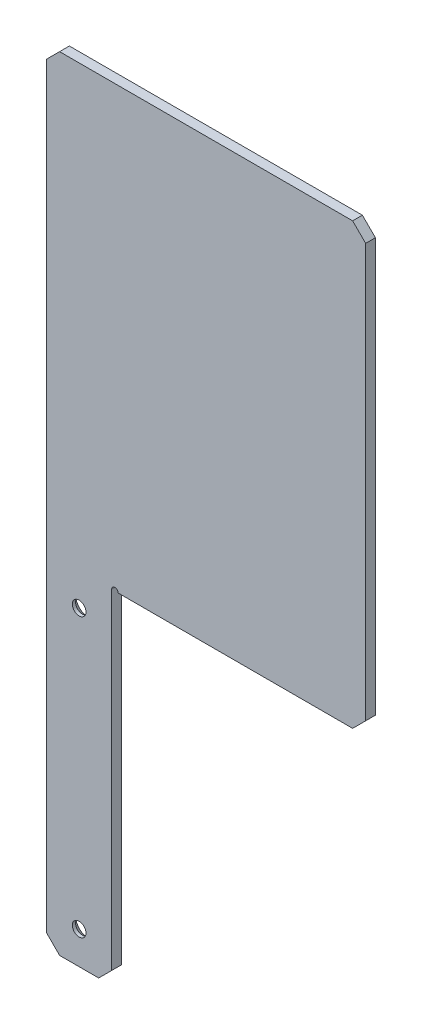
from build123d import *

# Parameters (mm, degrees)
EXTRUDE_1_DEPTH     = 1.5
CHAMFER_1_SIZE      = 4
SKETCH_2_R          = 1
CUT_EXTRUDE_1_DEPTH = 130.838515087
SKETCH_3_R          = 2.1
CUT_EXTRUDE_2_DEPTH = 130.838515087
CHAMFER_2_SIZE      = 2


with BuildPart() as part:
    # 草图1 → 凸台-拉伸1 (new, symmetric)
    with BuildSketch(Plane.XY):
        Polygon((-49, -120.2), (-29, -120.2), (-29, -14.8), (49, -14.8), (49, 120.2), (-49, 120.2), (-49, -14.8), align=None)
    extrude(amount=EXTRUDE_1_DEPTH, both=True)

    # 倒角1
    chamfer_1_edges = [part.edges().sort_by_distance(p)[0] for p in [
        (-49, 120.2, 0),
        (49, 120.2, 0),
        (49, -14.8, 0),
        (-29, -120.2, 0),
        (-49, -120.2, 0),
    ]]
    chamfer(chamfer_1_edges, length=CHAMFER_1_SIZE)

    # 草图2 → 切除-拉伸1 (cut, through all)
    with BuildSketch(Plane.XY.offset(1.5)):
        with Locations((-28, -14.8)):
            Circle(SKETCH_2_R)
    extrude(amount=-CUT_EXTRUDE_1_DEPTH, mode=Mode.SUBTRACT)

    # 草图3 → 切除-拉伸2 (cut, through all)
    with BuildSketch(Plane.XY.offset(1.5)):
        with Locations((-39, -110.2)):
            Circle(SKETCH_3_R)
        with Locations((-39, -24.8)):
            Circle(SKETCH_3_R)
    extrude(amount=-CUT_EXTRUDE_2_DEPTH, mode=Mode.SUBTRACT)

    # 倒角2
    chamfer_2_edges = [part.edges().sort_by_distance(p)[0] for p in [
        (-41.1, -110.2, -1.5),
        (-41.1, -24.8, -1.5),
    ]]
    chamfer(chamfer_2_edges, length=CHAMFER_2_SIZE)


solid = part.part
